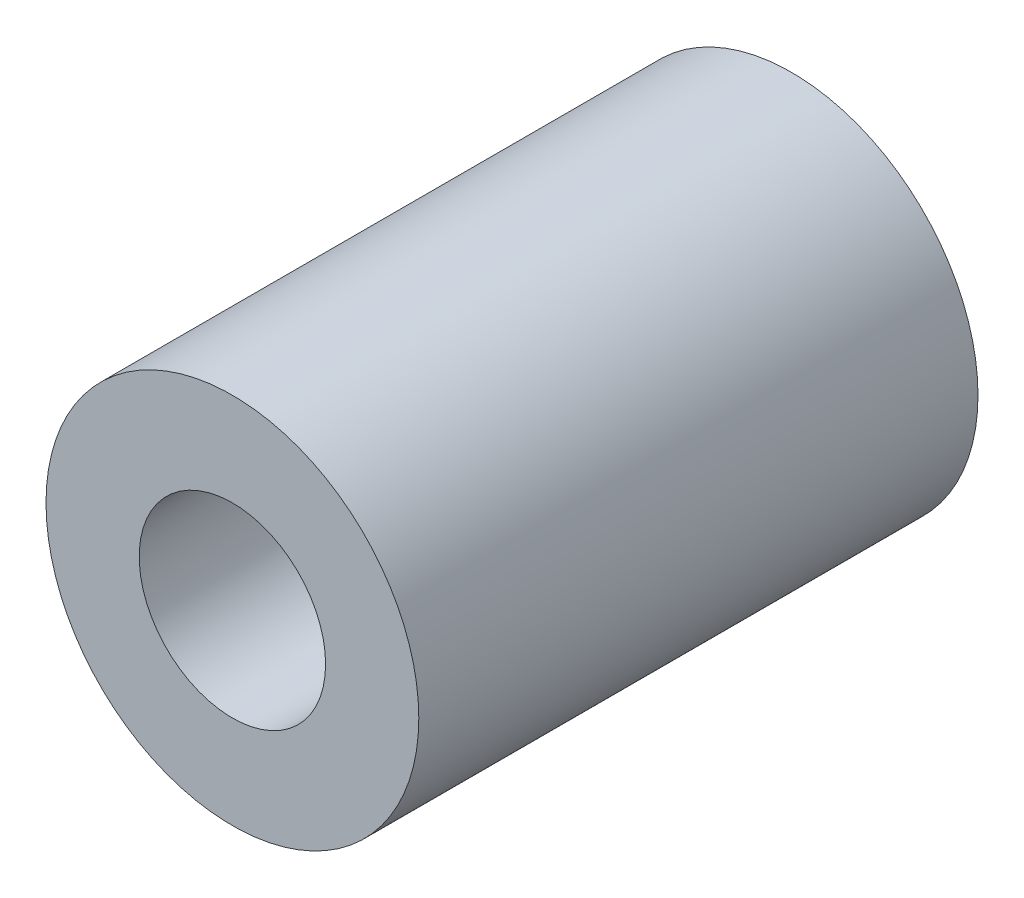
from build123d import *

# Parameters (mm, degrees)
SKETCH1_R           = 5
BOSS_EXTRUDE1_DEPTH = 15
SKETCH2_R           = 2.5
CUT_EXTRUDE1_DEPTH  = 4


with BuildPart() as part:
    # Sketch1 → Boss-Extrude1 (new body)
    with BuildSketch(Plane.XY):
        Circle(SKETCH1_R)
    extrude(amount=BOSS_EXTRUDE1_DEPTH)

    # Sketch2 → Cut-Extrude1 (cut)
    with BuildSketch(Plane.XY.offset(15)):
        Circle(SKETCH2_R)
    extrude(amount=-CUT_EXTRUDE1_DEPTH, mode=Mode.SUBTRACT)


solid = part.part
